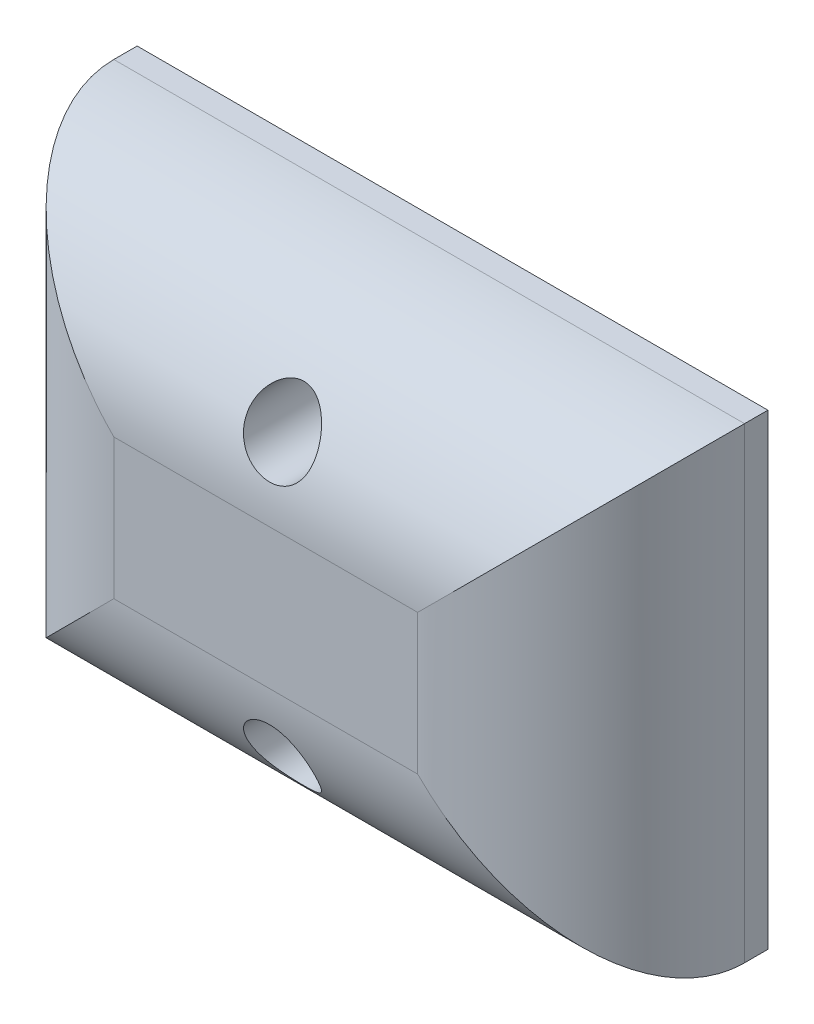
from build123d import *

# Parameters (mm, degrees)
SKIZZE1_W                                           = 135.069444444
SKIZZE1_H                                           = 100
AUFSATZ_LINEAR_AUSTRAGEN1_DEPTH                     = 40
SCHNITT_LINEAR_AUSTRAGEN1_DEPTH                     = 150.47827542
SCHNITT_LINEAR_AUSTRAGEN2_DEPTH                     = 128.125680748
STIRNSENKUNG_F_R_M8_SENKSCHRAUBE_KOPF_B_D           = 9
STIRNSENKUNG_F_R_M8_SENKSCHRAUBE_KOPF_B_CBORE_D     = 15
STIRNSENKUNG_F_R_M8_SENKSCHRAUBE_KOPF_B_CBORE_DEPTH = 35


with BuildPart() as part:
    # Skizze1 → Aufsatz-Linear austragen1 (new body)
    with BuildSketch(Plane.XY):
        Rectangle(SKIZZE1_W, SKIZZE1_H)
    extrude(amount=AUFSATZ_LINEAR_AUSTRAGEN1_DEPTH)

    # Skizze2 → Schnitt-Linear austragen1 (cut, through all)
    with BuildSketch(Plane(origin=(67.534722222, 0, 0), x_dir=(0, 0, -1), z_dir=(1, 0, 0))):
        with BuildLine():
            Line((-5, 50), (42.421873459, 50))
            Line((42.421873459, 50), (-56.728012939, 80.829845409))
            Line((-56.728012939, 80.829845409), (-40, -11.655385644))
            Line((-40, -11.655385644), (-40, 15))
            ThreePointArc((-40, 15), (-29.748737342, 39.748737342), (-5, 50))
        make_face()
    schnitt_linear_austragen1 = extrude(amount=-SCHNITT_LINEAR_AUSTRAGEN1_DEPTH, mode=Mode.SUBTRACT)

    # Spiegeln1: Schnitt-Linear austragen1 across plane
    add(schnitt_linear_austragen1.mirror(Plane.ZX), mode=Mode.SUBTRACT)

    # Skizze5 → Schnitt-Linear austragen2 (cut, through all)
    with BuildSketch(Plane(origin=(0, 50, 0), x_dir=(1, 0, 0), z_dir=(0, 1, 0))):
        with BuildLine():
            Line((-67.534722222, -5), (-67.534722222, -19.872389704))
            Line((-67.534722222, -19.872389704), (-98.364567631, -61.728012939))
            Line((-98.364567631, -61.728012939), (-5.879336578, -40))
            Line((-5.879336578, -40), (-32.534722222, -40))
            ThreePointArc((-32.534722222, -40), (-57.283459564, -29.748737342), (-67.534722222, -5))
        make_face()
    schnitt_linear_austragen2 = extrude(amount=-SCHNITT_LINEAR_AUSTRAGEN2_DEPTH, mode=Mode.SUBTRACT)

    # Spiegeln2: Schnitt-Linear austragen2 across plane
    add(schnitt_linear_austragen2.mirror(Plane(origin=(0, 0, 0), x_dir=(0, 0, 1), z_dir=(1, 0, 0))), mode=Mode.SUBTRACT)

    # Stirnsenkung für M8 Senkschraube (Kopf Button)3 (through all)
    with Locations(Plane.XY.offset(40)):
        with Locations((0, -30)):
            stirnsenkung_f_r_m8_senkschraube_kopf_b = CounterBoreHole(STIRNSENKUNG_F_R_M8_SENKSCHRAUBE_KOPF_B_D / 2, STIRNSENKUNG_F_R_M8_SENKSCHRAUBE_KOPF_B_CBORE_D / 2, STIRNSENKUNG_F_R_M8_SENKSCHRAUBE_KOPF_B_CBORE_DEPTH)

    # Spiegeln5: Stirnsenkung für M8 Senkschraube (Kopf Button)3 across plane
    add(stirnsenkung_f_r_m8_senkschraube_kopf_b.mirror(Plane.ZX), mode=Mode.SUBTRACT)


solid = part.part
